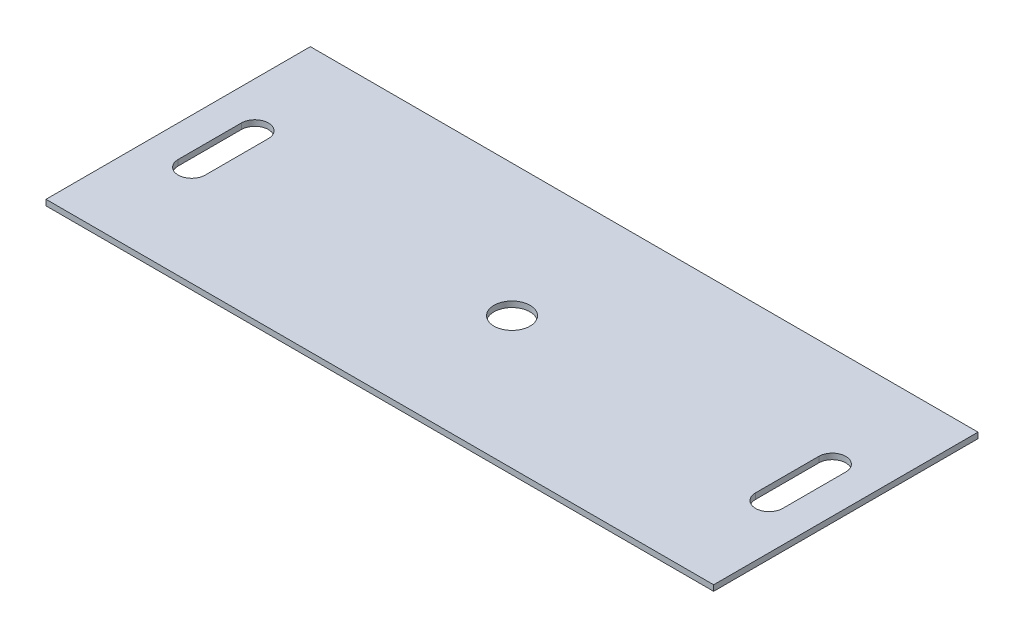
from build123d import *

# Parameters (mm, degrees)
SKETCH1_W         = 740
SKETCH1_H         = 293
BASE_DEPTH        = 6.35
HANDLES_DEPTH     = 398.998206654
SKETCH3_R         = 20
CAMERA_HOLE_DEPTH = 398.998206654


with BuildPart() as part:
    # Sketch1 → Base (new body)
    with BuildSketch(Plane(origin=(0, 0, 0), x_dir=(1, 0, 0), z_dir=(0, 1, 0))):
        Rectangle(SKETCH1_W, SKETCH1_H)
    extrude(amount=BASE_DEPTH)

    # Sketch2 → Handles (cut, through all)
    with BuildSketch(Plane(origin=(0, 6.35, 0), x_dir=(1, 0, 0), z_dir=(0, 1, 0))):
        with BuildLine():
            Line((-335, -35), (-335, 35))
            ThreePointArc((-335, 35), (-320, 50), (-305, 35))
            Line((-305, 35), (-305, -35))
            ThreePointArc((-305, -35), (-320, -50), (-335, -35))
        make_face()
        with BuildLine():
            Line((335, -35), (335, 35))
            ThreePointArc((335, 35), (320, 50), (305, 35))
            Line((305, 35), (305, -35))
            ThreePointArc((305, -35), (320, -50), (335, -35))
        make_face()
    extrude(amount=-HANDLES_DEPTH, mode=Mode.SUBTRACT)

    # Sketch3 → Camera Hole (cut, through all)
    with BuildSketch(Plane(origin=(0, 6.35, 0), x_dir=(1, 0, 0), z_dir=(0, 1, 0))):
        with Locations(Location((0, 0, 0), (0, 0, 270))):
            Circle(SKETCH3_R)
    extrude(amount=-CAMERA_HOLE_DEPTH, mode=Mode.SUBTRACT)


solid = part.part
